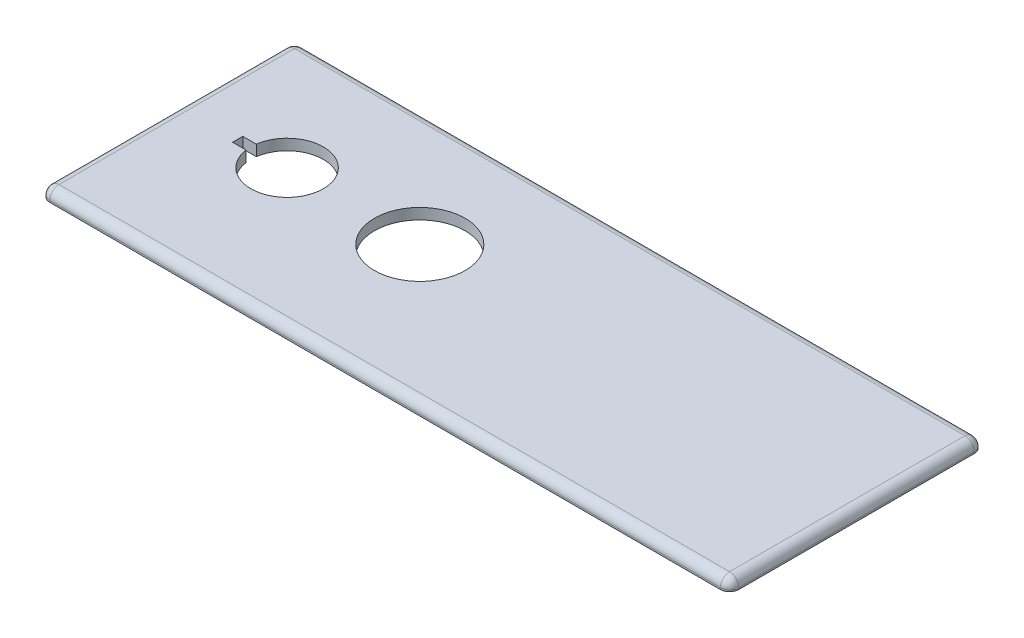
from build123d import *

# Parameters (mm, degrees)
SKETCH1_W           = 190
SKETCH1_H           = 70
BOSS_EXTRUDE1_DEPTH = 3
FILLET6_R           = 2.54
FILLET7_R           = 2.54
SKETCH2_R           = 12.5
CUT_EXTRUDE1_DEPTH  = 6.578222623


with BuildPart() as part:
    # Sketch1 → Boss-Extrude1 (new body)
    with BuildSketch(Plane(origin=(0, 0, 0), x_dir=(1, 0, 0), z_dir=(0, 1, 0))):
        Rectangle(SKETCH1_W, SKETCH1_H)
    extrude(amount=BOSS_EXTRUDE1_DEPTH)

    # Fillet6
    fillet6_edges = [part.edges().sort_by_distance(p)[0] for p in [
        (95, 1.5, 35),
        (-95, 1.5, 35),
        (-95, 1.5, -35),
        (95, 1.5, -35),
    ]]
    fillet(fillet6_edges, radius=FILLET6_R)

    # Fillet7
    fillet7_edges = [part.edges().sort_by_distance(p)[0] for p in [
        (0, 3, -35),
        (95, 3, 0),
        (-95, 3, 0),
        (0, 3, 35),
        (-94.256051224, 3, -34.256051224),
        (-94.256051224, 3, 34.256051224),
        (94.256051224, 3, 34.256051224),
        (94.256051224, 3, -34.256051224),
    ]]
    fillet(fillet7_edges, radius=FILLET7_R)

    # Sketch2 → Cut-Extrude1 (cut)
    with BuildSketch(Plane(origin=(0, 3, 0), x_dir=(1, 0, 0), z_dir=(0, 1, 0))):
        with BuildLine():
            ThreePointArc((-74.901262656, 4.383937879), (-75, 2.982154077), (-74.901262656, 1.580370275))
            Line((-74.901262656, 1.580370275), (-71.372168947, 1.580370275))
            Line((-71.372168947, 1.580370275), (-71.372168947, 4.383937879))
            Line((-71.372168947, 4.383937879), (-74.901262656, 4.383937879))
        make_face()
        with BuildLine():
            Line((-71.372168947, 1.580370275), (-74.901262656, 1.580370275))
            ThreePointArc((-74.901262656, 1.580370275), (-64.297371562, -6.993131046), (-55, 2.982154077))
            ThreePointArc((-55, 2.982154077), (-64.297371562, 12.9574392), (-74.901262656, 4.383937879))
            Line((-74.901262656, 4.383937879), (-71.372168947, 4.383937879))
            Line((-71.372168947, 4.383937879), (-71.372168947, 1.580370275))
        make_face()
        with Locations(Location((-28.415448, 2.982154077, 0), (0, 0, 270))):
            Circle(SKETCH2_R)
        with BuildLine():
            Line((-78.627831053, 4.383937879), (-78.627831053, 1.580370275))
            Line((-78.627831053, 1.580370275), (-74.901262656, 1.580370275))
            ThreePointArc((-74.901262656, 1.580370275), (-75, 2.982154077), (-74.901262656, 4.383937879))
            Line((-74.901262656, 4.383937879), (-78.627831053, 4.383937879))
        make_face()
    extrude(amount=-CUT_EXTRUDE1_DEPTH, mode=Mode.SUBTRACT)


solid = part.part
